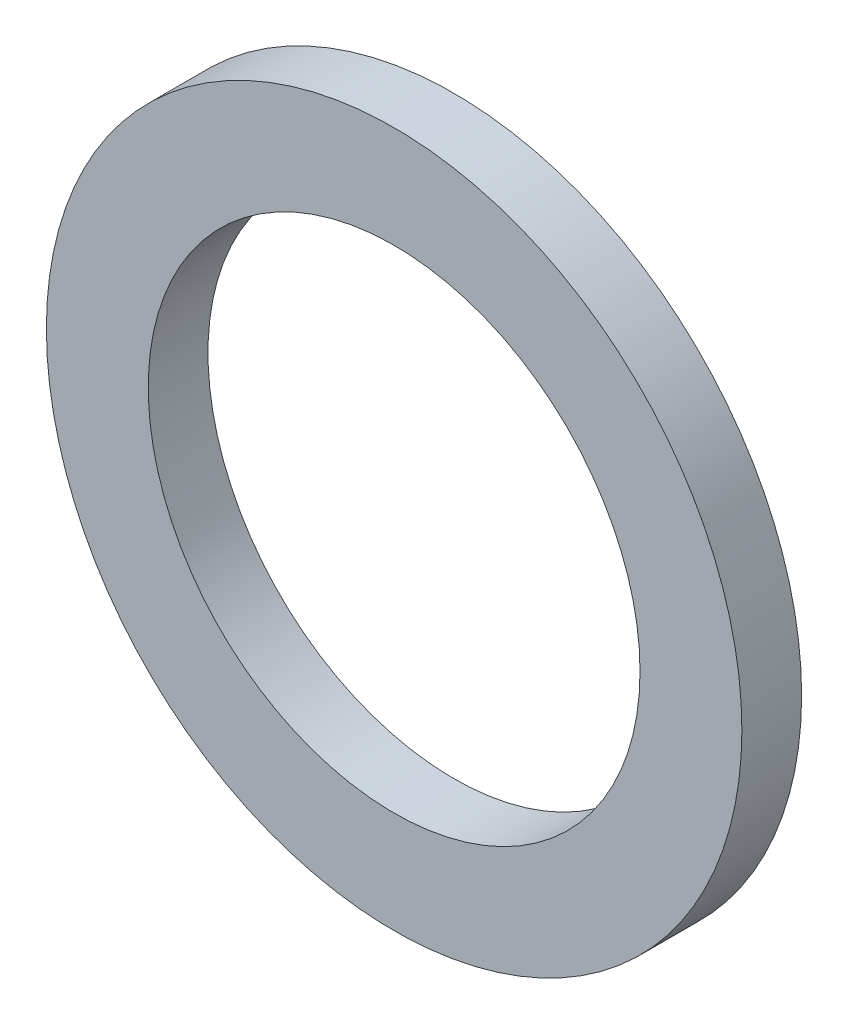
from build123d import *

# Parameters (mm, degrees)
ESQUISSE1_R          = 9.9
ESQUISSE1_R_2        = 7
BASE_EXTRUSION_DEPTH = 1.7


with BuildPart() as part:
    # Esquisse1 → Base-Extrusion (new body)
    with BuildSketch(Plane.XY):
        Circle(ESQUISSE1_R)
        Circle(ESQUISSE1_R_2, mode=Mode.SUBTRACT)
    extrude(amount=BASE_EXTRUSION_DEPTH)


solid = part.part
